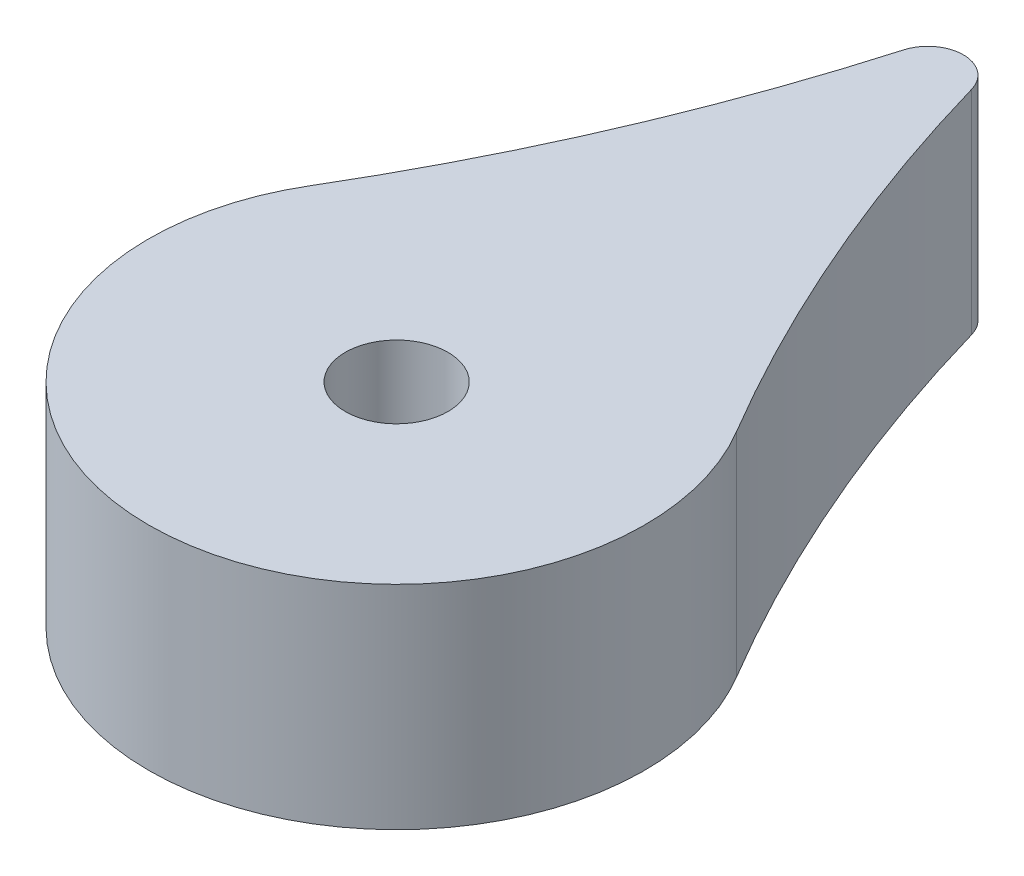
from build123d import *

# Parameters (mm, degrees)
BOSS_EXTRUDE1_DEPTH = 3
BOSS_EXTRUDE2_START = 3
SKETCH1_3_R         = 1.45
BOSS_EXTRUDE2_DEPTH = 3


with BuildPart() as part:
    # Sketch1 → Boss-Extrude1 (new body)
    with BuildSketch(Plane(origin=(0, 0, 0), x_dir=(1, 0, 0), z_dir=(0, 1, 0))):
        with BuildLine():
            ThreePointArc((-0.961022379, 15.276470588), (-3.11550152, 9.263204593), (-6.019034903, 3.573684211))
            ThreePointArc((-6.019034903, 3.573684211), (0, -7), (6.019034903, 3.573684211))
            ThreePointArc((6.019034903, 3.573684211), (3.11550152, 9.263204593), (0.961022379, 15.276470588))
            ThreePointArc((0.961022379, 15.276470588), (0, 16), (-0.961022379, 15.276470588))
        make_face()
        with BuildLine():
            Line((-3.122498999, 2.5), (3.122498999, 2.5))
            ThreePointArc((3.122498999, 2.5), (0, -4), (-3.122498999, 2.5))
        make_face(mode=Mode.SUBTRACT)
    extrude(amount=-BOSS_EXTRUDE1_DEPTH)

    # Sketch1<3> → Boss-Extrude2 (add)
    with BuildSketch(Plane(origin=(0, 0, 0), x_dir=(1, 0, 0), z_dir=(0, 1, 0)).offset(BOSS_EXTRUDE2_START)):
        with BuildLine():
            ThreePointArc((-0.961022379, 15.276470588), (-3.11550152, 9.263204593), (-6.019034903, 3.573684211))
            ThreePointArc((-6.019034903, 3.573684211), (0, -7), (6.019034903, 3.573684211))
            ThreePointArc((6.019034903, 3.573684211), (3.11550152, 9.263204593), (0.961022379, 15.276470588))
            ThreePointArc((0.961022379, 15.276470588), (0, 16), (-0.961022379, 15.276470588))
        make_face()
        Circle(SKETCH1_3_R, mode=Mode.SUBTRACT)
    extrude(amount=-BOSS_EXTRUDE2_DEPTH)


solid = part.part
